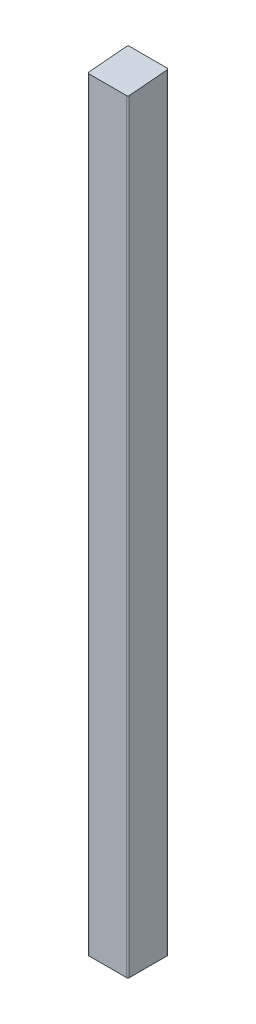
from build123d import *

# Parameters (mm, degrees)
BOSS_EXTRUDE1_DEPTH = 44.45
FILLET1_R           = 3.175


with BuildPart() as part:
    # Sketch1 → Boss-Extrude1 (new, symmetric)
    with BuildSketch(Plane(origin=(0, 0, 0), x_dir=(0, 0, -1), z_dir=(1, 0, 0))):
        Polygon((0, 0), (0, 1673.225), (88.9, 1681.002742187), (88.9, 0), align=None)
    extrude(amount=BOSS_EXTRUDE1_DEPTH, both=True)

    # Fillet1
    fillet1_edges = [part.edges().sort_by_distance(p)[0] for p in [
        (44.45, 836.6125, 0),
        (-44.45, 836.6125, 0),
        (-44.45, 840.501371094, -88.9),
        (44.45, 840.501371094, -88.9),
    ]]
    fillet(fillet1_edges, radius=FILLET1_R)


solid = part.part
